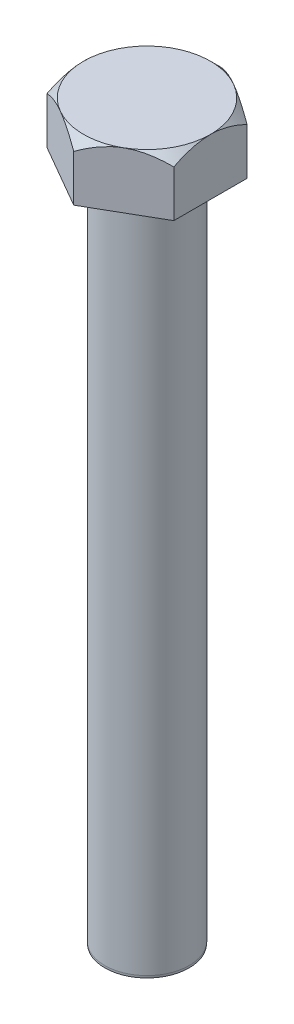
from build123d import *

# Parameters (mm, degrees)
BOSS_EXTRUDE1_DEPTH = 6.35
SKETCH2_R           = 4.7625
BOSS_EXTRUDE2_DEPTH = 76.2
SKETCH3_OUTSIDE_W   = 74.018
SKETCH3_OUTSIDE_H   = 76.23
SKETCH3_OUTSIDE_R   = 7.1501
CUT_EXTRUDE1_DEPTH  = 20.32
CUT_EXTRUDE1_DRAFT  = -45
CHAMFER1_SIZE       = 0.254
CHAMFER1_SIZE2      = 0.022222121


with BuildPart() as part:
    # Sketch1 → Boss-Extrude1 (new body)
    with BuildSketch(Plane(origin=(0, 0, 0), x_dir=(1, 0, 0), z_dir=(0, 1, 0))):
        Polygon((0, 8.256224319), (-7.1501, 4.12811216), (-7.1501, -4.12811216), (0, -8.256224319), (7.1501, -4.12811216), (7.1501, 4.12811216), align=None)
    extrude(amount=BOSS_EXTRUDE1_DEPTH)

    # Sketch2 → Boss-Extrude2 (add)
    with BuildSketch(Plane.XZ):
        with Locations(Location((0, 0, 0), (0, 0, 90))):
            Circle(SKETCH2_R)
    extrude(amount=BOSS_EXTRUDE2_DEPTH)


with BuildPart() as cut_extrude1_tool:
    # Sketch3 outside → Cut-Extrude1 (with draft: the straight prism first)
    with BuildSketch(Plane(origin=(0, 6.35, 0), x_dir=(1, 0, 0), z_dir=(0, 1, 0))):
        Rectangle(SKETCH3_OUTSIDE_W, SKETCH3_OUTSIDE_H)
        Circle(SKETCH3_OUTSIDE_R, mode=Mode.SUBTRACT)
    extrude(amount=-CUT_EXTRUDE1_DEPTH)
    # Cut-Extrude1: the draft: its side faces are tilted about the plane it starts from
    cut_extrude1_sides = [cut_extrude1_tool.faces().sort_by_distance(p)[0] for p in [
        (0, -3.81, 38.115),
        (37.009, -3.81, 0),
        (0, -3.81, -38.115),
        (-37.009, -3.81, 0),
        (-7.1501, -3.81, 0),
    ]]
    draft(cut_extrude1_sides, Plane(origin=(0, 6.35, 0), x_dir=(1, 0, 0), z_dir=(0, 1, 0)), CUT_EXTRUDE1_DRAFT)


with BuildPart() as part_1:
    add(part.part)

    # Cut-Extrude1: cut by cut_extrude1_tool
    add(cut_extrude1_tool.part, mode=Mode.SUBTRACT)

    # Chamfer1
    chamfer1_edges = [part_1.edges().sort_by_distance(p)[0] for p in [
        (0, -76.2, -4.7625),
    ]]
    chamfer1_side = [part_1.faces().sort_by_distance(p)[0] for p in [
        (0, -38.1, -4.7625),
    ]]
    chamfer(chamfer1_edges, length=CHAMFER1_SIZE, length2=CHAMFER1_SIZE2, reference=chamfer1_side[0])


solid = part_1.part
